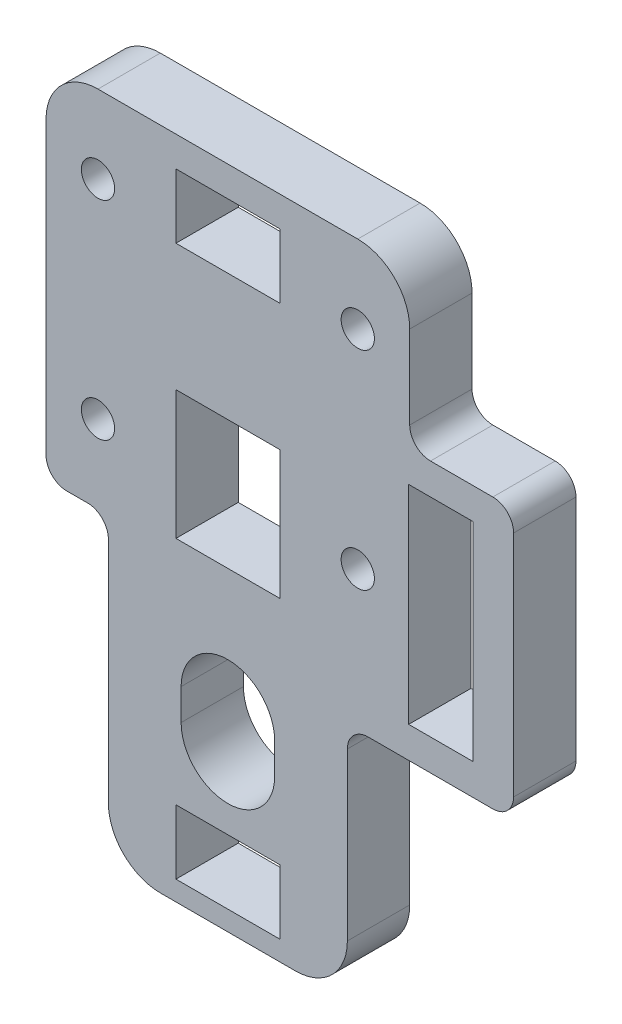
from build123d import *

# Parameters (mm, degrees)
SKETCH1_R           = 1.6
SKETCH1_W           = 10
SKETCH1_H           = 12.4
SKETCH1_H_2         = 6.2
BOSS_EXTRUDE1_DEPTH = 6
SKETCH4_W           = 6
SKETCH4_H           = 20
BOSS_EXTRUDE2_DEPTH = 10
SKETCH7_W           = 6
SKETCH7_H           = 6
BOSS_EXTRUDE3_DEPTH = 16
CUT_EXTRUDE1_REACH  = 58.509
SKETCH6_W           = 6.2
SKETCH6_H           = 20
FILLET1_R           = 2
FILLET2_R           = 5


with BuildPart() as part:
    # Sketch1 → Boss-Extrude1 (new body)
    with BuildSketch(Plane.XY):
        Polygon((17.5, -20), (11.5, -20), (11.5, -49), (-11.5, -49), (-11.5, -20), (-17.5, -20), (-17.5, 15), (17.5, 15), align=None)
        with Locations((12.5, 7.5)):
            Circle(SKETCH1_R, mode=Mode.SUBTRACT)
        with Locations((-12.5, 7.5)):
            Circle(SKETCH1_R, mode=Mode.SUBTRACT)
        with Locations((-12.5, -12.5)):
            Circle(SKETCH1_R, mode=Mode.SUBTRACT)
        with Locations((12.5, -12.5)):
            Circle(SKETCH1_R, mode=Mode.SUBTRACT)
        with Locations((0, -12.5)):
            Rectangle(SKETCH1_W, SKETCH1_H, mode=Mode.SUBTRACT)
        with Locations((0, 9)):
            Rectangle(SKETCH1_W, SKETCH1_H_2, mode=Mode.SUBTRACT)
        with BuildLine():
            Line((-4.5, -33.8), (-4.5, -30.8))
            ThreePointArc((-4.5, -30.8), (0, -26.3), (4.5, -30.8))
            Line((4.5, -30.8), (4.5, -33.8))
            ThreePointArc((4.5, -33.8), (0, -38.3), (-4.5, -33.8))
        make_face(mode=Mode.SUBTRACT)
        with Locations((0, -44)):
            Rectangle(SKETCH1_W, SKETCH1_H_2, mode=Mode.SUBTRACT)
    extrude(amount=BOSS_EXTRUDE1_DEPTH)

    # Sketch4 → Boss-Extrude2 (add)
    with BuildSketch(Plane(origin=(17.5, 0, 0), x_dir=(0, 0, -1), z_dir=(1, 0, 0))):
        with Locations((-3, -10)):
            Rectangle(SKETCH4_W, SKETCH4_H)
    extrude(amount=BOSS_EXTRUDE2_DEPTH)

    # Sketch7 → Boss-Extrude3 (add)
    with BuildSketch(Plane(origin=(11.5, 0, 0), x_dir=(0, 0, -1), z_dir=(1, 0, 0))):
        with Locations((-3, -23)):
            Rectangle(SKETCH7_W, SKETCH7_H)
    extrude(amount=BOSS_EXTRUDE3_DEPTH)

    # Sketch6 → Cut-Extrude1 (cut, up to next)
    with BuildSketch(Plane.XY.offset(6), mode=Mode.PRIVATE) as cut_extrude1_sk1:
        with Locations((20.5, -13)):
            Rectangle(SKETCH6_W, SKETCH6_H)
    cut_extrude1_tool1 = extrude(cut_extrude1_sk1.sketch, amount=-CUT_EXTRUDE1_REACH, mode=Mode.PRIVATE) & part.part
    add(cut_extrude1_tool1.solids().sort_by_distance((20.5, -13, 6))[0], mode=Mode.SUBTRACT)

    # Fillet1
    fillet1_edges = [part.edges().sort_by_distance(p)[0] for p in [
        (27.5, 0, 3),
        (11.5, -26, 3),
        (27.5, -26, 3),
        (-11.5, -20, 3),
        (-17.5, -20, 3),
        (17.5, 0, 3),
    ]]
    fillet(fillet1_edges, radius=FILLET1_R)

    # Fillet2
    fillet2_edges = [part.edges().sort_by_distance(p)[0] for p in [
        (-17.5, 15, 3),
        (17.5, 15, 3),
        (11.5, -49, 3),
        (-11.5, -49, 3),
    ]]
    fillet(fillet2_edges, radius=FILLET2_R)


solid = part.part
